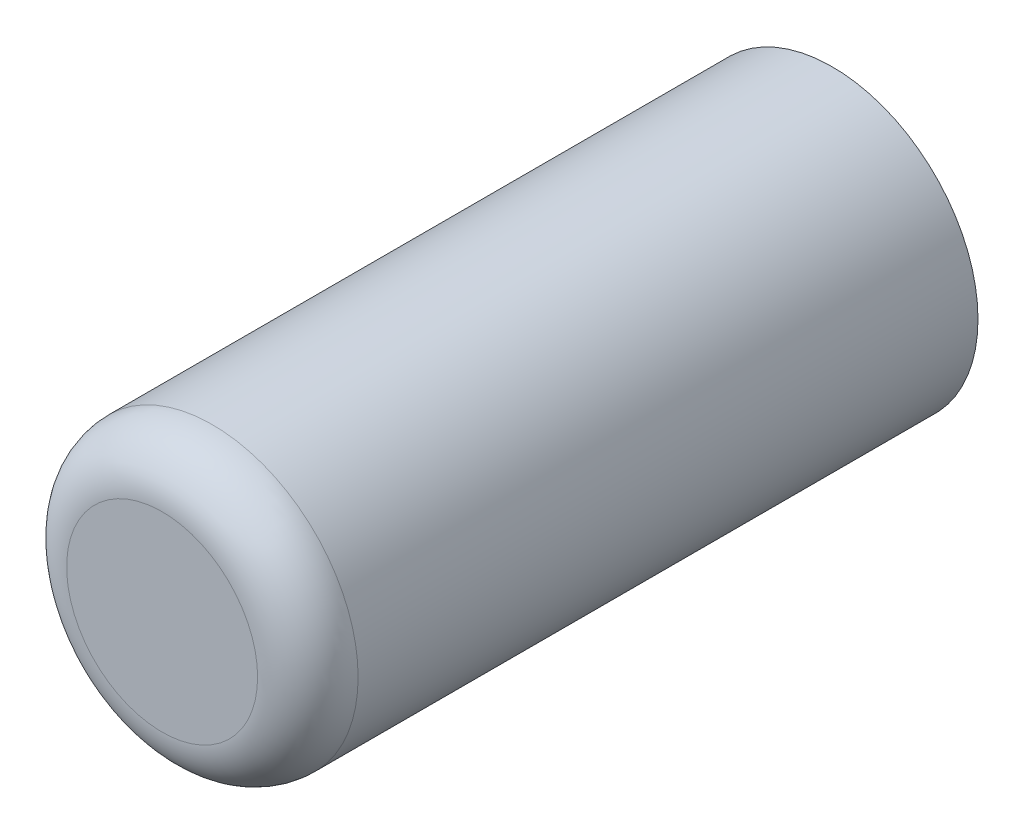
from build123d import *

# Parameters (mm, degrees)
SKETCH2_R           = 29
BOSS_EXTRUDE1_DEPTH = 133.35
FILLET1_R           = 10
SHELL1_T            = -1


with BuildPart() as part:
    # Sketch2 → Boss-Extrude1 (new body)
    with BuildSketch(Plane(origin=(0, 0, 0), x_dir=(0, 1, 0), z_dir=(0, 0, 1))):
        with Locations(Location((0, 0, 0), (0, 0, 270))):
            Circle(SKETCH2_R)
    extrude(amount=BOSS_EXTRUDE1_DEPTH)

    # Fillet1
    fillet1_edges = [part.edges().sort_by_distance(p)[0] for p in [
        (-29, 0, 133.35),
    ]]
    fillet(fillet1_edges, radius=FILLET1_R)

    # Shell1
    shell1_openings = [part.faces().sort_by_distance(p)[0] for p in [
        (0, 0, 0),
    ]]
    offset(amount=SHELL1_T, openings=shell1_openings, kind=Kind.INTERSECTION)


solid = part.part
